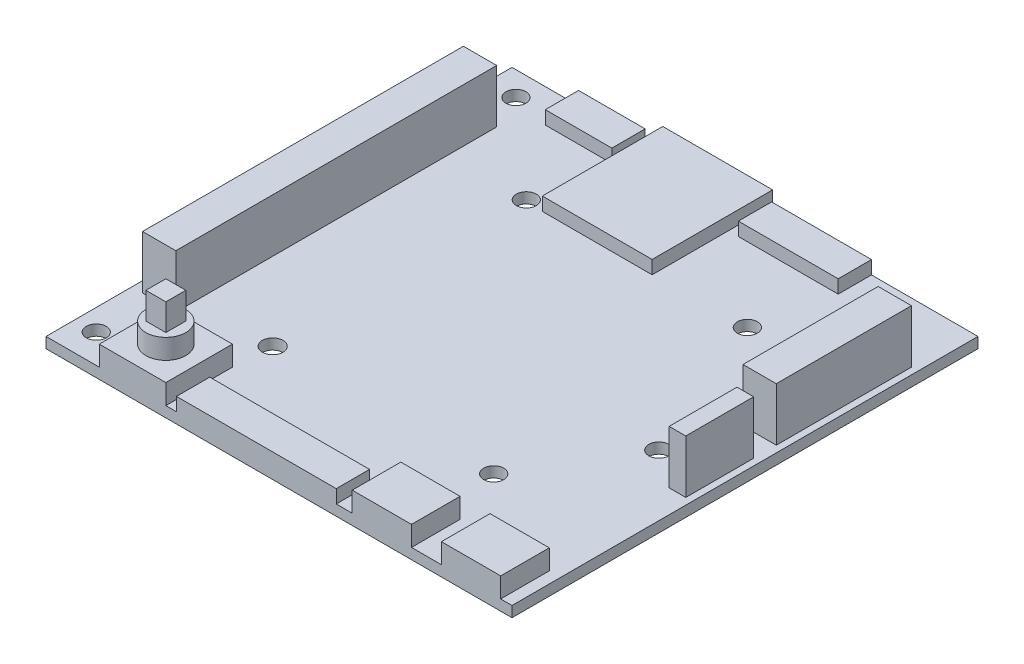
from build123d import *

# Parameters (mm, degrees)
SKETCH_1_W      = 70
SKETCH_1_H      = 70
SKETCH_1_R      = 1.55
SKETCH_1_R_2    = 1.5
EXTRUDE_1_DEPTH = 1.6
SKETCH_3_W      = 16.5
SKETCH_3_H      = 18.1
EXTRUDE_2_DEPTH = 2
SKETCH_5_W      = 8.9
SKETCH_5_H      = 7.3
EXTRUDE_3_DEPTH = 3
SKETCH_6_W      = 10
SKETCH_6_H      = 10
EXTRUDE_4_DEPTH = 3
SKETCH_7_R      = 3
EXTRUDE_5_DEPTH = 3
SKETCH_8_W      = 3
SKETCH_8_H      = 3
EXTRUDE_6_DEPTH = 4
SKETCH_9_W      = 24
SKETCH_9_H      = 5
SKETCH_9_W_2    = 10
SKETCH_9_W_3    = 15
EXTRUDE_7_DEPTH = 2
SKETCH_10_W     = 5
SKETCH_10_H     = 48.2
SKETCH_10_H_2   = 20.3
SKETCH_10_W_2   = 2.5
SKETCH_10_H_3   = 10.2
EXTRUDE_8_DEPTH = 8


with BuildPart() as part:
    # 草图1 → 凸台-拉伸1 (new body)
    with BuildSketch(Plane(origin=(0, 0, 0), x_dir=(1, 0, 0), z_dir=(0, 1, 0))):
        with Locations((16.69, 19.26)):
            Rectangle(SKETCH_1_W, SKETCH_1_H)
        with Locations(Location((0, 0, 0), (0, 0, 270))):
            Circle(SKETCH_1_R, mode=Mode.SUBTRACT)
        with Locations(Location((33.2, 0, 0), (0, 0, 270))):
            Circle(SKETCH_1_R_2, mode=Mode.SUBTRACT)
        with Locations(Location((0, 38.1, 0), (0, 0, 270))):
            Circle(SKETCH_1_R_2, mode=Mode.SUBTRACT)
        with Locations(Location((33.2, 38.1, 0), (0, 0, 270))):
            Circle(SKETCH_1_R_2, mode=Mode.SUBTRACT)
        with Locations(Location((-14.1, 50.64, 0), (0, 0, 270))):
            Circle(SKETCH_1_R_2, mode=Mode.SUBTRACT)
        with Locations(Location((41.9, 49.7, 0), (0, 0, 270))):
            Circle(SKETCH_1_R_2, mode=Mode.SUBTRACT)
        with Locations(Location((42.5, 15.5, 0), (0, 0, 270))):
            Circle(SKETCH_1_R_2, mode=Mode.SUBTRACT)
        with Locations(Location((-15.1, -11.4, 0), (0, 0, 270))):
            Circle(SKETCH_1_R_2, mode=Mode.SUBTRACT)
    extrude(amount=EXTRUDE_1_DEPTH)

    # 草图3 → 凸台-拉伸2 (add)
    with BuildSketch(Plane(origin=(0, 1.6, 0), x_dir=(1, 0, 0), z_dir=(0, 1, 0))):
        with Locations((10.95, 46.85)):
            Rectangle(SKETCH_3_W, SKETCH_3_H)
    extrude(amount=EXTRUDE_2_DEPTH)

    # 草图5 → 凸台-拉伸3 (add)
    with BuildSketch(Plane(origin=(0, 1.6, 0), x_dir=(1, 0, 0), z_dir=(0, 1, 0))):
        with Locations((45.54, -12.09)):
            Rectangle(SKETCH_5_W, SKETCH_5_H)
        with Locations((32.14, -12.09)):
            Rectangle(SKETCH_5_W, SKETCH_5_H)
    extrude(amount=EXTRUDE_3_DEPTH)

    # 草图6 → 凸台-拉伸4 (add)
    with BuildSketch(Plane(origin=(0, 1.6, 0), x_dir=(1, 0, 0), z_dir=(0, 1, 0))):
        with Locations((-5.31, -10.74)):
            Rectangle(SKETCH_6_W, SKETCH_6_H)
    extrude(amount=EXTRUDE_4_DEPTH)

    # 草图7 → 凸台-拉伸5 (add)
    with BuildSketch(Plane(origin=(0, 4.6, 0), x_dir=(1, 0, 0), z_dir=(0, 1, 0))):
        with Locations(Location((-5.31, -10.74, 0), (0, 0, 90))):
            Circle(SKETCH_7_R)
    extrude(amount=EXTRUDE_5_DEPTH)

    # 草图8 → 凸台-拉伸6 (add)
    with BuildSketch(Plane(origin=(0, 7.6, 0), x_dir=(1, 0, 0), z_dir=(0, 1, 0))):
        with Locations((-5.31, -10.74)):
            Rectangle(SKETCH_8_W, SKETCH_8_H)
    extrude(amount=EXTRUDE_6_DEPTH)

    # 草图9 → 凸台-拉伸7 (add)
    with BuildSketch(Plane(origin=(0, 1.6, 0), x_dir=(1, 0, 0), z_dir=(0, 1, 0))):
        with Locations((13.29, -13.24)):
            Rectangle(SKETCH_9_W, SKETCH_9_H)
        with Locations((-3.31, 51.76)):
            Rectangle(SKETCH_9_W_2, SKETCH_9_H)
        with Locations((28.19, 51.76)):
            Rectangle(SKETCH_9_W_3, SKETCH_9_H)
    extrude(amount=EXTRUDE_7_DEPTH)

    # 草图10 → 凸台-拉伸8 (add)
    with BuildSketch(Plane(origin=(0, 1.6, 0), x_dir=(1, 0, 0), z_dir=(0, 1, 0))):
        with Locations((-14.21, 21.26)):
            Rectangle(SKETCH_10_W, SKETCH_10_H)
        with Locations((48.19, 35.11)):
            Rectangle(SKETCH_10_W, SKETCH_10_H_2)
        with Locations((49.44, 16.46)):
            Rectangle(SKETCH_10_W_2, SKETCH_10_H_3)
    extrude(amount=EXTRUDE_8_DEPTH)


solid = part.part
